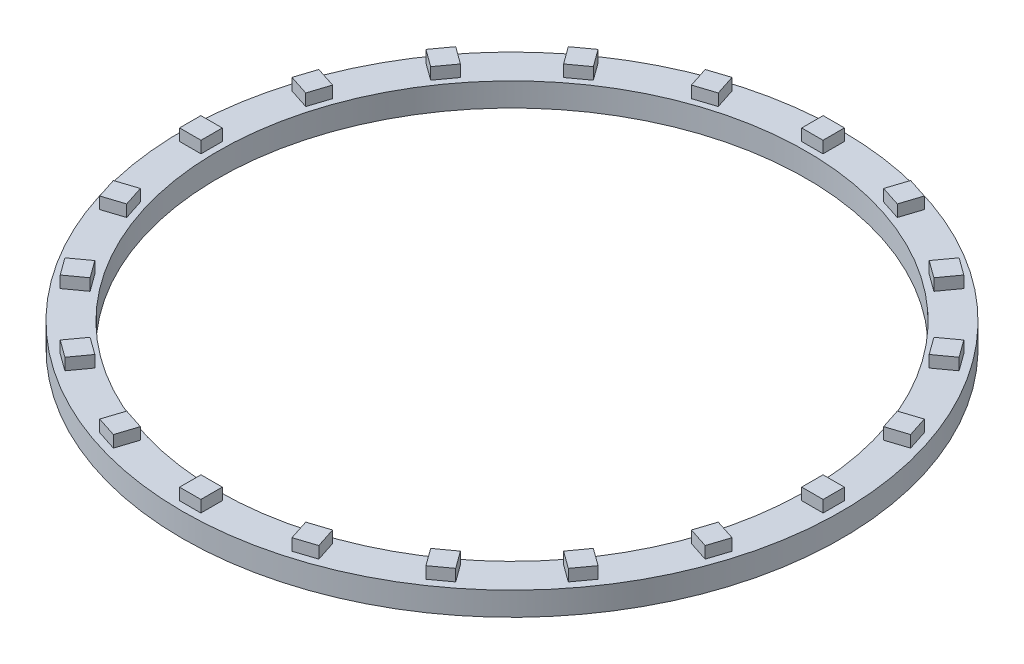
from build123d import *

# Parameters (mm, degrees)
SKETCH_1_R      = 28
SKETCH_1_R_2    = 25
EXTRUDE_1_DEPTH = 2
SKETCH_2_W      = 1.809411118
SKETCH_2_H      = 1.819947288
SKETCH_2_W_2    = 1.819947288
SKETCH_2_H_2    = 1.809411118
EXTRUDE_2_DEPTH = 1


with BuildPart() as part:
    # 草图1 → 凸台-拉伸1 (new body)
    with BuildSketch(Plane(origin=(0, 0, 0), x_dir=(1, 0, 0), z_dir=(0, 1, 0))):
        with Locations(Location((0, 0, 0), (0, 0, 270))):
            Circle(SKETCH_1_R)
        with Locations(Location((0, 0, 0), (0, 0, 270))):
            Circle(SKETCH_1_R_2, mode=Mode.SUBTRACT)
    extrude(amount=EXTRUDE_1_DEPTH)

    # 草图2 → 凸台-拉伸2 (add)
    with BuildSketch(Plane(origin=(0, 2, 0), x_dir=(1, 0, 0), z_dir=(0, 1, 0))):
        Polygon((7.587666599, 26.280125266), (9.308518833, 25.720986481), (8.746124192, 23.990113753), (7.025271959, 24.549252538), align=None)
        with Locations((0, 26.428628666)):
            Rectangle(SKETCH_2_W, SKETCH_2_H)
        Polygon((15.337305084, 22.649166456), (16.801149428, 21.585621286), (15.731411252, 20.113253001), (14.267566908, 21.176798171), align=None)
        Polygon((21.585621286, 16.801149428), (22.649166456, 15.337305084), (21.176798171, 14.267566908), (20.113253001, 15.731411252), align=None)
        Polygon((25.720986481, 9.308518833), (26.280125266, 7.587666599), (24.549252538, 7.025271959), (23.990113753, 8.746124192), align=None)
        with Locations((26.428628666, 0)):
            Rectangle(SKETCH_2_W_2, SKETCH_2_H_2)
        Polygon((26.280125266, -7.587666599), (25.720986481, -9.308518833), (23.990113753, -8.746124192), (24.549252538, -7.025271959), align=None)
        Polygon((22.649166456, -15.337305084), (21.585621286, -16.801149428), (20.113253001, -15.731411252), (21.176798171, -14.267566908), align=None)
        Polygon((16.801149428, -21.585621286), (15.337305084, -22.649166456), (14.267566908, -21.176798171), (15.731411252, -20.113253001), align=None)
        Polygon((9.308518833, -25.720986481), (7.587666599, -26.280125266), (7.025271959, -24.549252538), (8.746124192, -23.990113753), align=None)
        with Locations((0, -26.428628666)):
            Rectangle(SKETCH_2_W, SKETCH_2_H)
        Polygon((-7.587666599, -26.280125266), (-9.308518833, -25.720986481), (-8.746124192, -23.990113753), (-7.025271959, -24.549252538), align=None)
        Polygon((-15.337305084, -22.649166456), (-16.801149428, -21.585621286), (-15.731411252, -20.113253001), (-14.267566908, -21.176798171), align=None)
        Polygon((-21.585621286, -16.801149428), (-22.649166456, -15.337305084), (-21.176798171, -14.267566908), (-20.113253001, -15.731411252), align=None)
        Polygon((-25.720986481, -9.308518833), (-26.280125266, -7.587666599), (-24.549252538, -7.025271959), (-23.990113753, -8.746124192), align=None)
        with Locations((-26.428628666, 0)):
            Rectangle(SKETCH_2_W_2, SKETCH_2_H_2)
        Polygon((-26.280125266, 7.587666599), (-25.720986481, 9.308518833), (-23.990113753, 8.746124192), (-24.549252538, 7.025271959), align=None)
        Polygon((-22.649166456, 15.337305084), (-21.585621286, 16.801149428), (-20.113253001, 15.731411252), (-21.176798171, 14.267566908), align=None)
        Polygon((-16.801149428, 21.585621286), (-15.337305084, 22.649166456), (-14.267566908, 21.176798171), (-15.731411252, 20.113253001), align=None)
        Polygon((-9.308518833, 25.720986481), (-7.587666599, 26.280125266), (-7.025271959, 24.549252538), (-8.746124192, 23.990113753), align=None)
    extrude(amount=EXTRUDE_2_DEPTH)


solid = part.part
